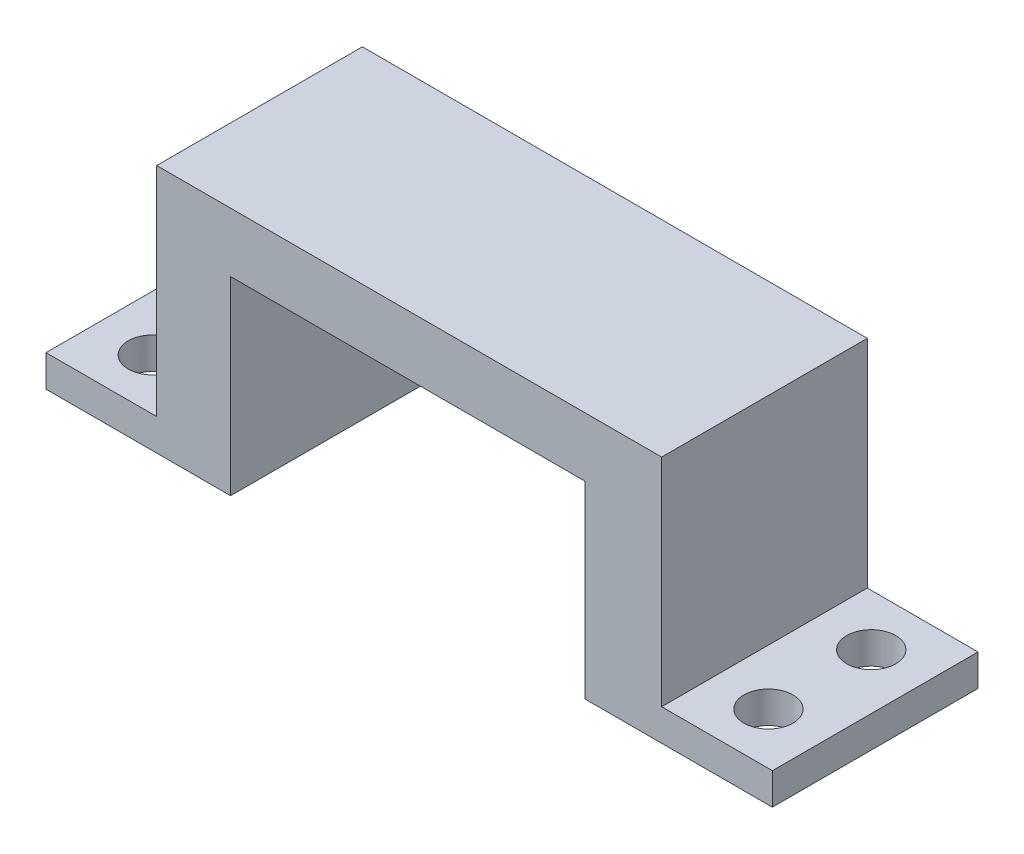
from build123d import *

# Parameters (mm, degrees)
SKETCH1_W               = 4.671
SKETCH1_H               = 15.746
SKETCH1_W_2             = 7
SKETCH1_H_2             = 2
SKETCH1_W_3             = 22.4
SKETCH1_H_3             = 3.746
BOSS_EXTRUDE1_DEPTH     = 13
CUT_EXTRUDE1_DEPTH      = 60.119451433
CUT_EXTRUDE1_DEPTH_BACK = 60.119451433
SKETCH2_R               = 1.55


with BuildPart() as part:
    # Sketch1 → Boss-Extrude1 (new body)
    with BuildSketch(Plane.XY):
        with Locations((-46.693035151, 12.873)):
            Rectangle(SKETCH1_W, SKETCH1_H)
        with Locations((-52.528535151, 6)):
            Rectangle(SKETCH1_W_2, SKETCH1_H_2)
        with Locations((-33.157535151, 18.873)):
            Rectangle(SKETCH1_W_3, SKETCH1_H_3)
        Polygon((-21.957535151, 20.746), (-21.957535151, 17), (-21.957535151, 5.074394878), (-17.106930028, 5.074394878), (-17.106930028, 7.074394878), (-17.106930028, 20.746), align=None)
        with Locations((-13.606930028, 6.074394878)):
            Rectangle(SKETCH1_W_2, SKETCH1_H_2)
    extrude(amount=BOSS_EXTRUDE1_DEPTH)

    # Sketch2 → Cut-Extrude1 (cut, two sides: drawn at the far end of the back side and taken through both)
    with BuildSketch(Plane(origin=(0, 7.074394878, 0), x_dir=(1, 0, 0), z_dir=(0, 1, 0)).offset(-CUT_EXTRUDE1_DEPTH_BACK)):
        with Locations(Location((-13.606930028, -9.75, 0), (0, 0, 270))):
            Circle(SKETCH2_R)
        with Locations(Location((-13.606930028, -3.25, 0), (0, 0, 270))):
            Circle(SKETCH2_R)
        with Locations(Location((-52.528535151, -3.25, 0), (0, 0, 270))):
            Circle(SKETCH2_R)
        with Locations((-52.528535151, -9.75)):
            Circle(SKETCH2_R)
    extrude(amount=CUT_EXTRUDE1_DEPTH + CUT_EXTRUDE1_DEPTH_BACK, mode=Mode.SUBTRACT)


solid = part.part
